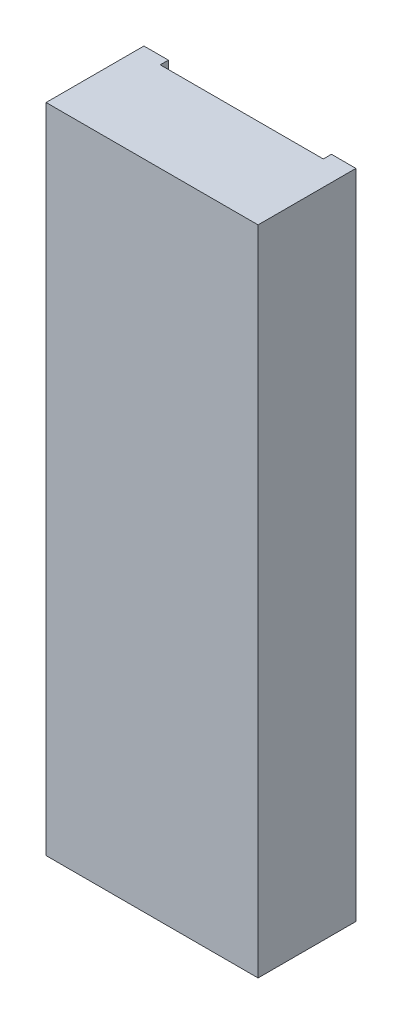
from build123d import *

# Parameters (mm, degrees)
SKETCH1_W           = 130
SKETCH1_H           = 400
BOSS_EXTRUDE1_DEPTH = 60
SKETCH2_W           = 100
SKETCH2_H           = 400
CUT_EXTRUDE1_DEPTH  = 5


with BuildPart() as part:
    # Sketch1 → Boss-Extrude1 (new body)
    with BuildSketch(Plane.XY):
        Rectangle(SKETCH1_W, SKETCH1_H)
    extrude(amount=BOSS_EXTRUDE1_DEPTH)

    # Sketch2 → Cut-Extrude1 (cut)
    with BuildSketch(Plane(origin=(0, 0, 0), x_dir=(-1, 0, 0), z_dir=(0, 0, -1))):
        Rectangle(SKETCH2_W, SKETCH2_H)
    extrude(amount=-CUT_EXTRUDE1_DEPTH, mode=Mode.SUBTRACT)


solid = part.part
